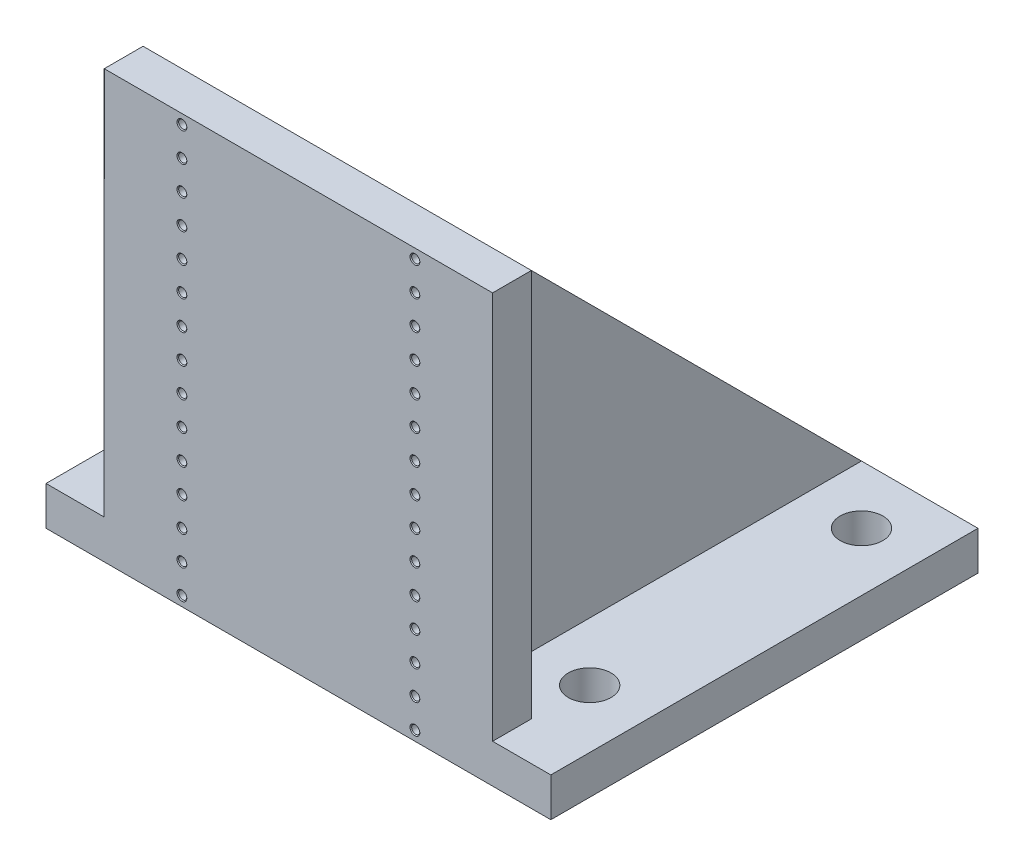
from build123d import *

# Parameters (mm, degrees)
ESBO_O1_W                      = 200
ESBO_O1_H                      = 200
RESSALTO_EXTRUS_O1_DEPTH       = 20
RESSALTO_EXTRUS_O2_DEPTH       = 10
ESBO_O3_W                      = 260
ESBO_O3_H                      = 220
RESSALTO_EXTRUS_O3_DEPTH       = 20
CORTE_EXTRUS_O1_REACH          = 326.5
ESBO_O4_R                      = 11
PADR_O_LINEAR1_COUNT           = 2
PADR_O_LINEAR1_PITCH           = 100
PADR_O_LINEAR1_COL_COUNT       = 2
PADR_O_LINEAR1_COL_PITCH       = 100
PADR_O_LINEAR2_COUNT           = 2
PADR_O_LINEAR2_PITCH           = 140
PADR_O_LINEAR2_COPY_1_REACH    = 326.5
PADR_O_LINEAR2_COPY_1_SKETCH_R = 11
PADR_O_LINEAR2_COPY_2_REACH    = 326.5
PADR_O_LINEAR2_COPY_2_SKETCH_R = 11
PADR_O_LINEAR3_COUNT           = 15
PADR_O_LINEAR3_PITCH           = 15


with BuildPart() as part:
    # Esboço1 → Ressalto-extrusão1 (new body)
    with BuildSketch(Plane.XY):
        with Locations((0, 100)):
            Rectangle(ESBO_O1_W, ESBO_O1_H)
    extrude(amount=-RESSALTO_EXTRUS_O1_DEPTH)

    # Esboço2 → Ressalto-extrusão2 (add, symmetric)
    with BuildSketch(Plane(origin=(60, 0, 0), x_dir=(0, 0, -1), z_dir=(1, 0, 0))):
        Polygon((20, 0), (20, 200), (220, 0), align=None)
    ressalto_extrus_o2 = extrude(amount=RESSALTO_EXTRUS_O2_DEPTH, both=True)

    # Espelhar1: Ressalto-extrusão2 across plane
    add(ressalto_extrus_o2.mirror(Plane(origin=(0, 0, 0), x_dir=(0, 0, 1), z_dir=(1, 0, 0))))

    # Esboço3 → Ressalto-extrusão3 (add)
    with BuildSketch(Plane.XZ):
        with Locations((0, -110)):
            Rectangle(ESBO_O3_W, ESBO_O3_H)
    extrude(amount=RESSALTO_EXTRUS_O3_DEPTH)

    # Esboço4 → Corte-extrusão1 (cut, up to next)
    with BuildSketch(Plane(origin=(0, 0, 0), x_dir=(1, 0, 0), z_dir=(0, 1, 0)), mode=Mode.PRIVATE) as corte_extrus_o1_sk1:
        with Locations(Location((0, 190, 0), (0, 0, 180))):
            Circle(ESBO_O4_R)
    corte_extrus_o1_tool1 = extrude(corte_extrus_o1_sk1.sketch, amount=-CORTE_EXTRUS_O1_REACH, mode=Mode.PRIVATE) & part.part
    corte_extrus_o1 = corte_extrus_o1_tool1.solids().sort_by_distance((0, 0, -190))[0]
    add(corte_extrus_o1, mode=Mode.SUBTRACT)

    # Padrão linear1: Corte-extrusão1 ×2
    with Locations(*[(i * PADR_O_LINEAR1_PITCH, 0, 0) for i in range(1, PADR_O_LINEAR1_COUNT)]):
        add(corte_extrus_o1, mode=Mode.SUBTRACT)

    # Padrão linear1 col: Corte-extrusão1 ×2
    with Locations(*[(-i * PADR_O_LINEAR1_COL_PITCH, 0, 0) for i in range(1, PADR_O_LINEAR1_COL_COUNT)]):
        add(corte_extrus_o1, mode=Mode.SUBTRACT)

    # Padrão linear2: Corte-extrusão1 ×2
    with Locations(*[(0, 0, i * PADR_O_LINEAR2_PITCH) for i in range(1, PADR_O_LINEAR2_COUNT)]):
        add(corte_extrus_o1, mode=Mode.SUBTRACT)

    # Padrão linear2 copy 1 sketch → Padrão linear2 copy 1 (cut, up to next)
    with BuildSketch(Plane(origin=(100, 0, 140), x_dir=(1, 0, 0), z_dir=(0, 1, 0)), mode=Mode.PRIVATE) as padr_o_linear2_copy_1_sk1:
        with Locations(Location((0, 190, 0), (0, 0, 180))):
            Circle(PADR_O_LINEAR2_COPY_1_SKETCH_R)
    padr_o_linear2_copy_1_tool1 = extrude(padr_o_linear2_copy_1_sk1.sketch, amount=-PADR_O_LINEAR2_COPY_1_REACH, mode=Mode.PRIVATE) & part.part
    add(padr_o_linear2_copy_1_tool1.solids().sort_by_distance((100, 0, -50))[0], mode=Mode.SUBTRACT)

    # Padrão linear2 copy 2 sketch → Padrão linear2 copy 2 (cut, up to next)
    with BuildSketch(Plane(origin=(-100, 0, 140), x_dir=(1, 0, 0), z_dir=(0, 1, 0)), mode=Mode.PRIVATE) as padr_o_linear2_copy_2_sk1:
        with Locations(Location((0, 190, 0), (0, 0, 180))):
            Circle(PADR_O_LINEAR2_COPY_2_SKETCH_R)
    padr_o_linear2_copy_2_tool1 = extrude(padr_o_linear2_copy_2_sk1.sketch, amount=-PADR_O_LINEAR2_COPY_2_REACH, mode=Mode.PRIVATE) & part.part
    add(padr_o_linear2_copy_2_tool1.solids().sort_by_distance((-100, 0, -50))[0], mode=Mode.SUBTRACT)

    # Esboço7 → Furo roscado de M51 (revolve, cut)
    with BuildSketch(Plane(origin=(-60, -15, 0), x_dir=(0, -1, 0), z_dir=(1, 0, 0))):
        Polygon((0, 0), (0, 28.2618073), (2.1, 27), (2.1, 0.425), (2.525, 0), align=None)
    furo_roscado_de_m51 = revolve(axis=Axis((-60, -15, 6.35), (0, 0, -1)), mode=Mode.SUBTRACT)

    # Padrão linear3: Furo roscado de M51 ×15
    with Locations(*[(0, i * PADR_O_LINEAR3_PITCH, 0) for i in range(1, PADR_O_LINEAR3_COUNT)]):
        add(furo_roscado_de_m51, mode=Mode.SUBTRACT)

    # Espelhar2: Furo roscado de M51 across plane
    add(furo_roscado_de_m51.mirror(Plane(origin=(0, 0, 0), x_dir=(0, 0, 1), z_dir=(1, 0, 0))), mode=Mode.SUBTRACT)

    # Espelhar2 copy 1 sketch → Espelhar2 copy 1 (revolve, cut)
    with BuildSketch(Plane(origin=(60, 0, 0), x_dir=(0, -1, 0), z_dir=(-1, 0, 0))):
        Polygon((0, 0), (0, -28.2618073), (2.1, -27), (2.1, -0.425), (2.525, 0), align=None)
    revolve(axis=Axis((60, 0, 6.35), (0, 0, 1)), mode=Mode.SUBTRACT)

    # Espelhar2 copy 2 sketch → Espelhar2 copy 2 (revolve, cut)
    with BuildSketch(Plane(origin=(60, 15, 0), x_dir=(0, -1, 0), z_dir=(-1, 0, 0))):
        Polygon((0, 0), (0, -28.2618073), (2.1, -27), (2.1, -0.425), (2.525, 0), align=None)
    revolve(axis=Axis((60, 15, 6.35), (0, 0, 1)), mode=Mode.SUBTRACT)

    # Espelhar2 copy 3 sketch → Espelhar2 copy 3 (revolve, cut)
    with BuildSketch(Plane(origin=(60, 30, 0), x_dir=(0, -1, 0), z_dir=(-1, 0, 0))):
        Polygon((0, 0), (0, -28.2618073), (2.1, -27), (2.1, -0.425), (2.525, 0), align=None)
    revolve(axis=Axis((60, 30, 6.35), (0, 0, 1)), mode=Mode.SUBTRACT)

    # Espelhar2 copy 4 sketch → Espelhar2 copy 4 (revolve, cut)
    with BuildSketch(Plane(origin=(60, 45, 0), x_dir=(0, -1, 0), z_dir=(-1, 0, 0))):
        Polygon((0, 0), (0, -28.2618073), (2.1, -27), (2.1, -0.425), (2.525, 0), align=None)
    revolve(axis=Axis((60, 45, 6.35), (0, 0, 1)), mode=Mode.SUBTRACT)

    # Espelhar2 copy 5 sketch → Espelhar2 copy 5 (revolve, cut)
    with BuildSketch(Plane(origin=(60, 60, 0), x_dir=(0, -1, 0), z_dir=(-1, 0, 0))):
        Polygon((0, 0), (0, -28.2618073), (2.1, -27), (2.1, -0.425), (2.525, 0), align=None)
    revolve(axis=Axis((60, 60, 6.35), (0, 0, 1)), mode=Mode.SUBTRACT)

    # Espelhar2 copy 6 sketch → Espelhar2 copy 6 (revolve, cut)
    with BuildSketch(Plane(origin=(60, 75, 0), x_dir=(0, -1, 0), z_dir=(-1, 0, 0))):
        Polygon((0, 0), (0, -28.2618073), (2.1, -27), (2.1, -0.425), (2.525, 0), align=None)
    revolve(axis=Axis((60, 75, 6.35), (0, 0, 1)), mode=Mode.SUBTRACT)

    # Espelhar2 copy 7 sketch → Espelhar2 copy 7 (revolve, cut)
    with BuildSketch(Plane(origin=(60, 90, 0), x_dir=(0, -1, 0), z_dir=(-1, 0, 0))):
        Polygon((0, 0), (0, -28.2618073), (2.1, -27), (2.1, -0.425), (2.525, 0), align=None)
    revolve(axis=Axis((60, 90, 6.35), (0, 0, 1)), mode=Mode.SUBTRACT)

    # Espelhar2 copy 8 sketch → Espelhar2 copy 8 (revolve, cut)
    with BuildSketch(Plane(origin=(60, 105, 0), x_dir=(0, -1, 0), z_dir=(-1, 0, 0))):
        Polygon((0, 0), (0, -28.2618073), (2.1, -27), (2.1, -0.425), (2.525, 0), align=None)
    revolve(axis=Axis((60, 105, 6.35), (0, 0, 1)), mode=Mode.SUBTRACT)

    # Espelhar2 copy 9 sketch → Espelhar2 copy 9 (revolve, cut)
    with BuildSketch(Plane(origin=(60, 120, 0), x_dir=(0, -1, 0), z_dir=(-1, 0, 0))):
        Polygon((0, 0), (0, -28.2618073), (2.1, -27), (2.1, -0.425), (2.525, 0), align=None)
    revolve(axis=Axis((60, 120, 6.35), (0, 0, 1)), mode=Mode.SUBTRACT)

    # Espelhar2 copy 10 sketch → Espelhar2 copy 10 (revolve, cut)
    with BuildSketch(Plane(origin=(60, 135, 0), x_dir=(0, -1, 0), z_dir=(-1, 0, 0))):
        Polygon((0, 0), (0, -28.2618073), (2.1, -27), (2.1, -0.425), (2.525, 0), align=None)
    revolve(axis=Axis((60, 135, 6.35), (0, 0, 1)), mode=Mode.SUBTRACT)

    # Espelhar2 copy 11 sketch → Espelhar2 copy 11 (revolve, cut)
    with BuildSketch(Plane(origin=(60, 150, 0), x_dir=(0, -1, 0), z_dir=(-1, 0, 0))):
        Polygon((0, 0), (0, -28.2618073), (2.1, -27), (2.1, -0.425), (2.525, 0), align=None)
    revolve(axis=Axis((60, 150, 6.35), (0, 0, 1)), mode=Mode.SUBTRACT)

    # Espelhar2 copy 12 sketch → Espelhar2 copy 12 (revolve, cut)
    with BuildSketch(Plane(origin=(60, 165, 0), x_dir=(0, -1, 0), z_dir=(-1, 0, 0))):
        Polygon((0, 0), (0, -28.2618073), (2.1, -27), (2.1, -0.425), (2.525, 0), align=None)
    revolve(axis=Axis((60, 165, 6.35), (0, 0, 1)), mode=Mode.SUBTRACT)

    # Espelhar2 copy 13 sketch → Espelhar2 copy 13 (revolve, cut)
    with BuildSketch(Plane(origin=(60, 180, 0), x_dir=(0, -1, 0), z_dir=(-1, 0, 0))):
        Polygon((0, 0), (0, -28.2618073), (2.1, -27), (2.1, -0.425), (2.525, 0), align=None)
    revolve(axis=Axis((60, 180, 6.35), (0, 0, 1)), mode=Mode.SUBTRACT)

    # Espelhar2 copy 14 sketch → Espelhar2 copy 14 (revolve, cut)
    with BuildSketch(Plane(origin=(60, 195, 0), x_dir=(0, -1, 0), z_dir=(-1, 0, 0))):
        Polygon((0, 0), (0, -28.2618073), (2.1, -27), (2.1, -0.425), (2.525, 0), align=None)
    revolve(axis=Axis((60, 195, 6.35), (0, 0, 1)), mode=Mode.SUBTRACT)


solid = part.part
